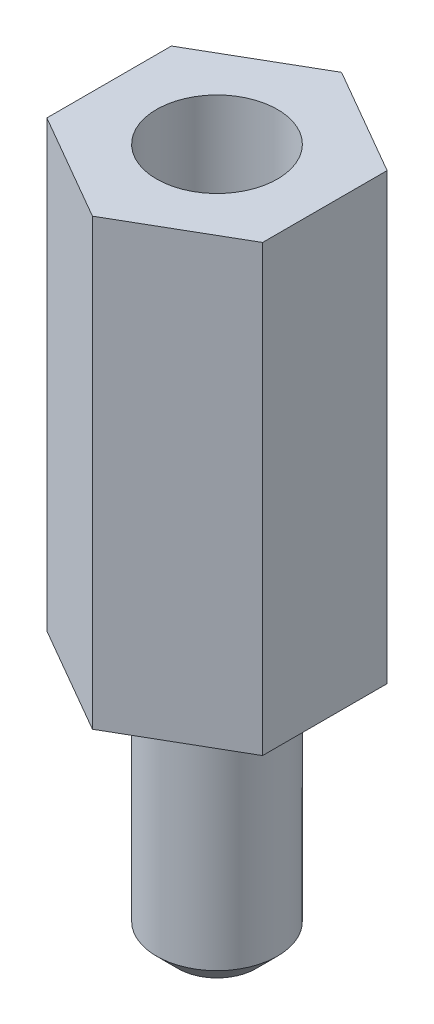
from build123d import *

# Parameters (mm, degrees)
EXTRUDE_1_DEPTH     = 10.3
SKETCH_2_R          = 1.4
EXTRUDE_2_DEPTH     = 5.8
CHAMFER_1_SIZE      = 0.5
SKETCH_3_R          = 1.4
CUT_EXTRUDE_1_DEPTH = 7


with BuildPart() as part:
    # Эскиз1 → Бобышка-Вытянуть1 (new body)
    with BuildSketch(Plane(origin=(0, 0, 0), x_dir=(1, 0, 0), z_dir=(0, 1, 0))):
        Polygon((0, 2.886751346), (-2.5, 1.443375673), (-2.5, -1.443375673), (0, -2.886751346), (2.5, -1.443375673), (2.5, 1.443375673), align=None)
    extrude(amount=EXTRUDE_1_DEPTH)

    # Эскиз2 → Бобышка-Вытянуть2 (add)
    with BuildSketch(Plane.XZ):
        with Locations(Location((0, 0, 0), (0, 0, 270))):
            Circle(SKETCH_2_R)
    extrude(amount=EXTRUDE_2_DEPTH)

    # Фаска1
    chamfer_1_edges = [part.edges().sort_by_distance(p)[0] for p in [
        (0, -5.8, 1.4),
    ]]
    chamfer(chamfer_1_edges, length=CHAMFER_1_SIZE)

    # Эскиз3 → Вырез-Вытянуть1 (cut)
    with BuildSketch(Plane(origin=(0, 10.3, 0), x_dir=(1, 0, 0), z_dir=(0, 1, 0))):
        with Locations(Location((0, 0, 0), (0, 0, 90))):
            Circle(SKETCH_3_R)
    extrude(amount=-CUT_EXTRUDE_1_DEPTH, mode=Mode.SUBTRACT)


solid = part.part
